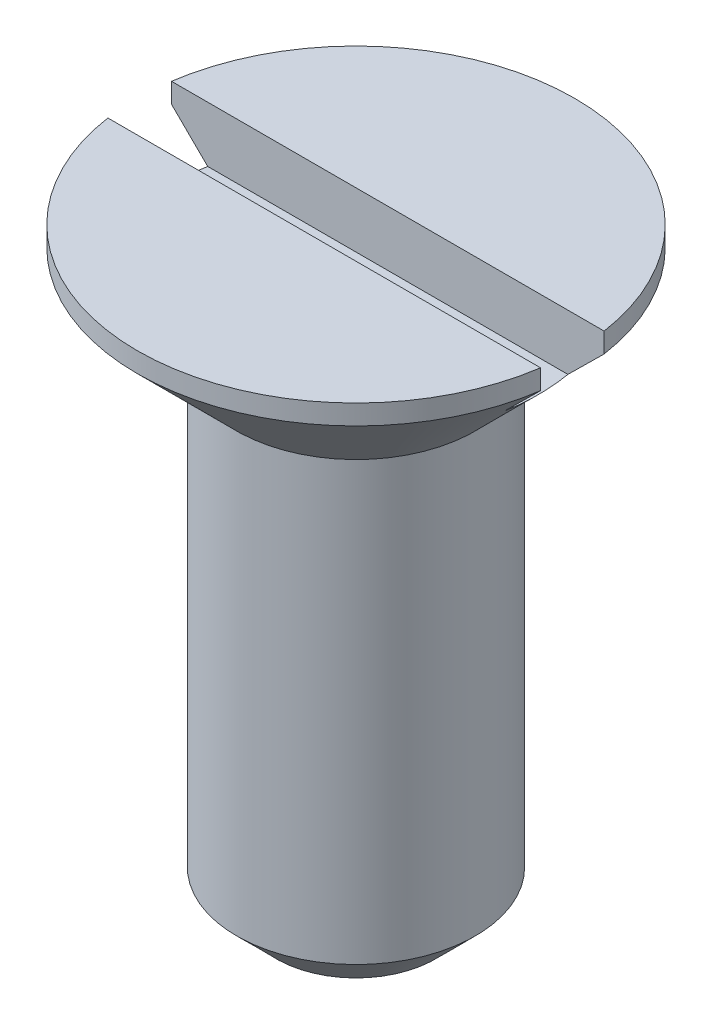
from build123d import *

# Parameters (mm, degrees)
SKETCH_13_W         = 11
SKETCH_13_H         = 1.6
CUT_EXTRUDE_9_DEPTH = 1.4
CHAMFER_1_SIZE      = 1


with BuildPart() as part:
    # Эскиз1 → Повернуть1 (revolve)
    with BuildSketch(Plane.XY):
        Polygon((0, 92.035042223), (0, 77.035042223), (3, 77.035042223), (3, 89.035042223), (5.5, 91.535042223), (5.5, 92.035042223), align=None)
    revolve(axis=Axis((0, 125.763182898, 0), (0, -1, 0)))

    # Эскиз13 → Вырез-Вытянуть9 (cut)
    with BuildSketch(Plane(origin=(0, 92.035042223, 0), x_dir=(-1, 0, 0), z_dir=(0, 1, 0))):
        Rectangle(SKETCH_13_W, SKETCH_13_H)
    extrude(amount=-CUT_EXTRUDE_9_DEPTH, mode=Mode.SUBTRACT)

    # Фаска1
    chamfer_1_edges = [part.edges().sort_by_distance(p)[0] for p in [
        (-3, 77.035042223, 0),
    ]]
    chamfer(chamfer_1_edges, length=CHAMFER_1_SIZE)


solid = part.part
